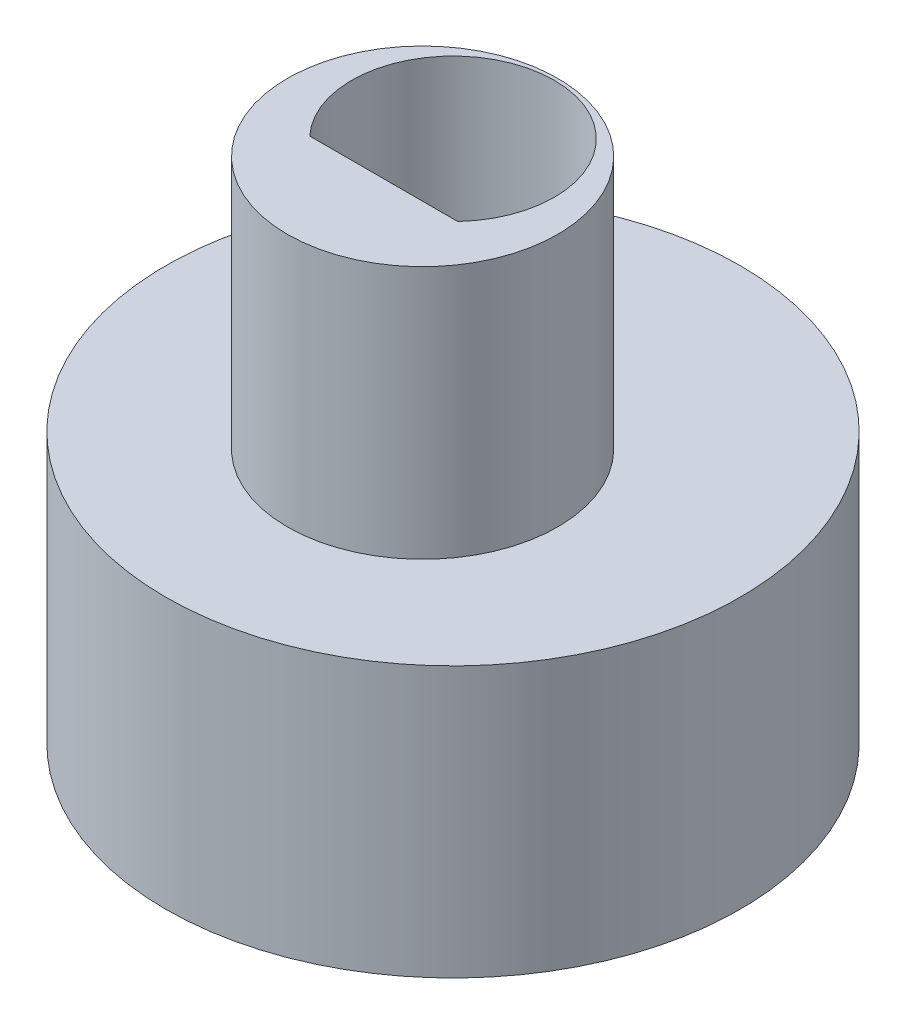
from build123d import *
from build123d.topology import SkipClean

# Parameters (mm, degrees)
SKETCH1_R           = 4
BOSS_EXTRUDE1_DEPTH = 7.5
CUT_EXTRUDE2_DEPTH  = 10
BOSS_EXTRUDE3_START = 8
SKETCH4_R           = 8.5
BOSS_EXTRUDE3_DEPTH = 8


with BuildPart() as part:
    # Sketch1 → Boss-Extrude1 (new body)
    with BuildSketch(Plane(origin=(0, 0, 0), x_dir=(1, 0, 0), z_dir=(0, 1, 0))):
        with Locations(Location((0, 0, 0), (0, 0, 270))):
            Circle(SKETCH1_R)
    extrude(amount=BOSS_EXTRUDE1_DEPTH)

    # Sketch2 → Cut-Extrude2 (cut)
    with BuildSketch(Plane(origin=(0, 0, 0), x_dir=(-1, 0, 0), z_dir=(0, -1, 0))):
        with BuildLine():
            Line((-2.190319611, -1.15), (2.190319611, -1.15))
            ThreePointArc((2.190319611, -1.15), (2.790247196, -0.202052895), (3, 0.9))
            ThreePointArc((3, 0.9), (-1.102052895, 3.690247196), (-2.190319611, -1.15))
        make_face()
    extrude(amount=-CUT_EXTRUDE2_DEPTH, mode=Mode.SUBTRACT)

    # Sketch4 → Boss-Extrude3 (add)
    with SkipClean():  # the faces are left unmerged after this step: merging them gives an invalid solid
        with BuildSketch(Plane(origin=(0, 0, 0), x_dir=(-1, 0, 0), z_dir=(0, -1, 0)).offset(BOSS_EXTRUDE3_START)):
            with Locations(Location((0, 0.9, 0), (0, 0, 90))):
                Circle(SKETCH4_R)
            with BuildLine():
                Line((2.190319611, -1.15), (-2.190319611, -1.15))
                ThreePointArc((-2.190319611, -1.15), (0, 3.9), (2.190319611, -1.15))
            make_face(mode=Mode.SUBTRACT)
        extrude(amount=-BOSS_EXTRUDE3_DEPTH)


solid = part.part
